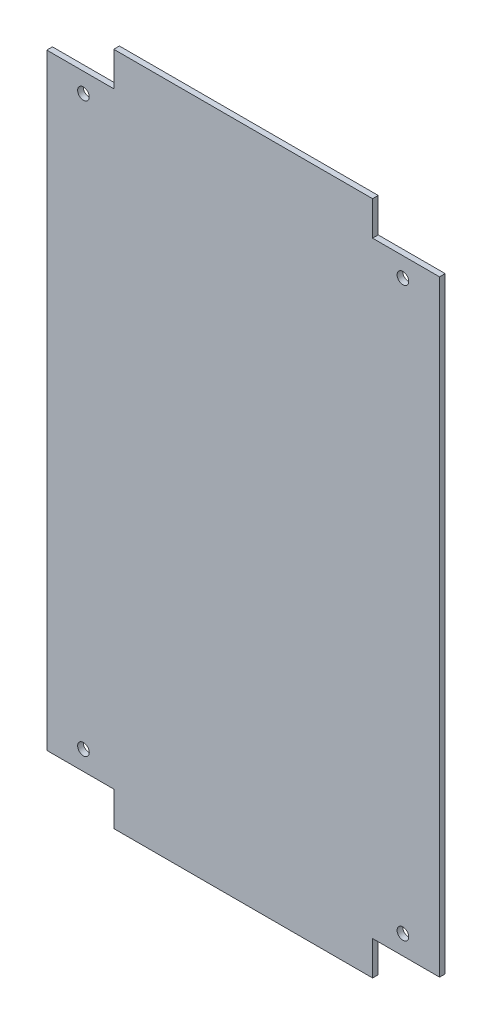
from build123d import *

# Parameters (mm, degrees)
BOSS_EXTRUDE1_DEPTH = 1.6
CUT_EXTRUDE1_DEPTH  = 1.6


with BuildPart() as part:
    # Sketch2 → Boss-Extrude1 (new body)
    with BuildSketch(Plane.XY):
        Polygon((5193.573840828, 1803.237079941), (5212.573840828, 1803.237079941), (5212.573840828, 1812.937079941), (5285.973840828, 1812.937079941), (5285.973840828, 1803.237079941), (5304.973840828, 1803.237079941), (5304.973840828, 1631.237079941), (5285.973840828, 1631.237079941), (5285.973840828, 1621.537079941), (5212.573840828, 1621.537079941), (5212.573840828, 1631.237079941), (5193.573840828, 1631.237079941), align=None)
    extrude(amount=BOSS_EXTRUDE1_DEPTH)

    # Sketch3 → Cut-Extrude1 (cut)
    with BuildSketch(Plane.XY.offset(1.6)):
        with BuildLine():
            ThreePointArc((5202.323840828, 1797.736928772), (5203.973840828, 1796.086928772), (5205.623840828, 1797.736928772))
            ThreePointArc((5205.623840828, 1797.736928772), (5203.973840828, 1799.386928772), (5202.323840828, 1797.736928772))
        make_face()
        with BuildLine():
            ThreePointArc((5296.223840828, 1797.736928772), (5294.573840828, 1799.386928772), (5292.923840828, 1797.736928772))
            ThreePointArc((5292.923840828, 1797.736928772), (5294.573840828, 1796.086928772), (5296.223840828, 1797.736928772))
        make_face()
        with BuildLine():
            ThreePointArc((5296.223840828, 1636.736928772), (5294.573840828, 1638.386928772), (5292.923840828, 1636.736928772))
            ThreePointArc((5292.923840828, 1636.736928772), (5294.573840828, 1635.086928772), (5296.223840828, 1636.736928772))
        make_face()
        with BuildLine():
            ThreePointArc((5205.623840828, 1636.736928772), (5203.973840828, 1638.386928772), (5202.323840828, 1636.736928772))
            ThreePointArc((5202.323840828, 1636.736928772), (5203.973840828, 1635.086928772), (5205.623840828, 1636.736928772))
        make_face()
    extrude(amount=-CUT_EXTRUDE1_DEPTH, mode=Mode.SUBTRACT)


solid = part.part
